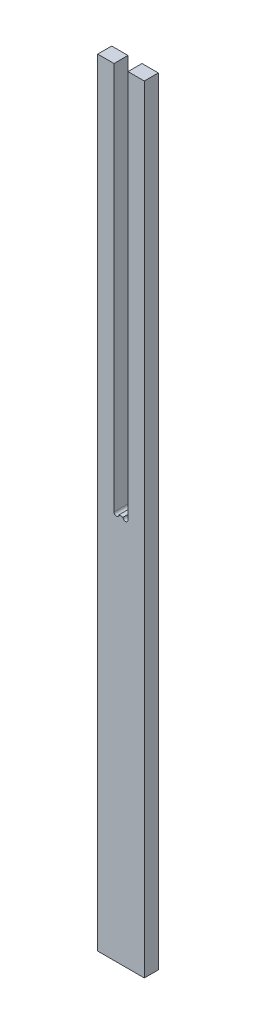
from build123d import *

# Parameters (mm, degrees)
ESTRUSIONE_ESTRUSIONE1_DEPTH = 18


with BuildPart() as part:
    # Schizzo1 → Estrusione-Estrusione1 (new body)
    with BuildSketch(Plane.XY):
        with BuildLine():
            Line((-51.222222222, 825), (-51.222222222, 325))
            ThreePointArc((-51.222222222, 325), (-48.047222222, 321.825), (-44.872222222, 325))
            Line((-44.872222222, 325), (-39.572222222, 325))
            ThreePointArc((-39.572222222, 325), (-36.397222222, 321.825), (-33.222222222, 325))
            Line((-33.222222222, 325), (-33.222222222, 825))
            Line((-33.222222222, 825), (-12.222222222, 825))
            Line((-12.222222222, 825), (-12.222222222, -175))
            Line((-12.222222222, -175), (-72.222222222, -175))
            Line((-72.222222222, -175), (-72.222222222, 825))
            Line((-72.222222222, 825), (-51.222222222, 825))
        make_face()
    extrude(amount=ESTRUSIONE_ESTRUSIONE1_DEPTH)


solid = part.part
